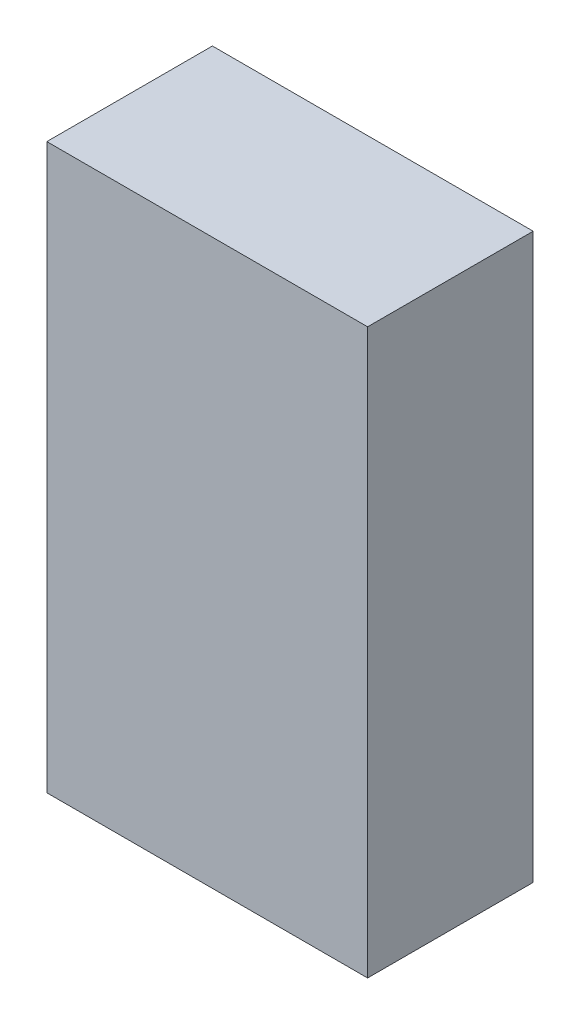
from build123d import *

# Parameters (mm, degrees)
ESTRUSIONE_ESTRUSIONE1_DEPTH      = 16
ESTRUSIONE_ESTRUSIONE1_DEPTH_BACK = 16
SCHIZZO1_W                        = 62
SCHIZZO1_H                        = 109


with BuildPart() as part:
    # Schizzo1 → Estrusione-Estrusione1 (new, two sides: drawn at the far end of the back side and taken through both)
    with BuildSketch(Plane.XY.offset(-ESTRUSIONE_ESTRUSIONE1_DEPTH_BACK)):
        Rectangle(SCHIZZO1_W, SCHIZZO1_H)
    extrude(amount=ESTRUSIONE_ESTRUSIONE1_DEPTH + ESTRUSIONE_ESTRUSIONE1_DEPTH_BACK)


solid = part.part
